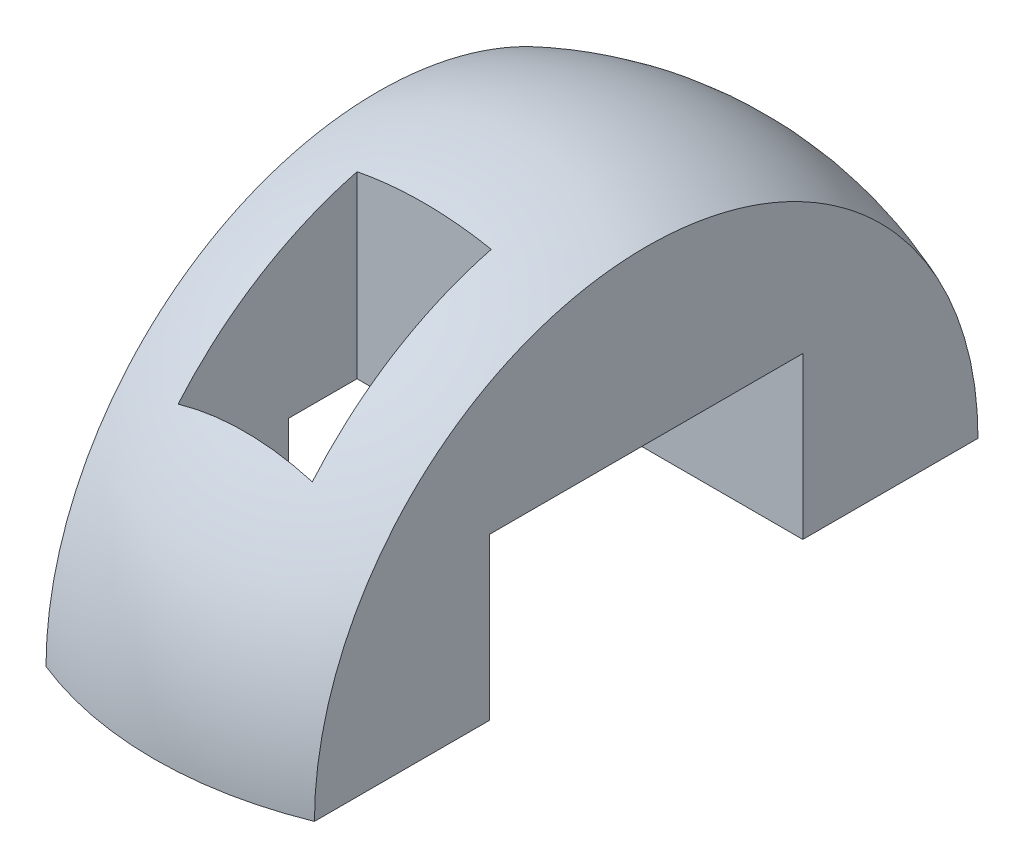
from build123d import *

# Parameters (mm, degrees)
SKETCH2_W          = 50
SKETCH2_H          = 80
CUT_EXTRUDE1_DEPTH = 196.959179423
SKETCH3_W          = 70
SKETCH3_H          = 36
CUT_EXTRUDE2_DEPTH = 129.062484749
SKETCH5_W          = 30
SKETCH5_H          = 40
CUT_EXTRUDE3_DEPTH = 118.046999107


with BuildPart() as part:
    # Sketch1 → Revolve2 (revolve)
    with BuildSketch(Plane.XY):
        with BuildLine():
            Line((0, 0), (80, 0))
            ThreePointArc((80, 0), (56.568542495, 56.568542495), (0, 80))
            Line((0, 80), (0, 0))
        make_face()
    revolve(axis=Axis((0, 0, 0), (0, 1, 0)))

    # Sketch2 → Cut-Extrude1 (cut, through all)
    with BuildSketch(Plane.XY.offset(80)):
        with Locations((55, 40)):
            Rectangle(SKETCH2_W, SKETCH2_H)
        with Locations((-55, 40)):
            Rectangle(SKETCH2_W, SKETCH2_H)
    extrude(amount=-CUT_EXTRUDE1_DEPTH, mode=Mode.SUBTRACT)

    # Sketch3 → Cut-Extrude2 (cut, through all)
    with BuildSketch(Plane.ZY.offset(30)):
        with Locations((0, 18)):
            Rectangle(SKETCH3_W, SKETCH3_H)
    extrude(amount=-CUT_EXTRUDE2_DEPTH, mode=Mode.SUBTRACT)

    # Sketch5 → Cut-Extrude3 (cut, through all)
    with BuildSketch(Plane(origin=(0, 80, 0), x_dir=(-1, 0, 0), z_dir=(0, -1, 0))):
        with Locations((-0.075942229, -39.717020611)):
            Rectangle(SKETCH5_W, SKETCH5_H)
    extrude(amount=CUT_EXTRUDE3_DEPTH, mode=Mode.SUBTRACT)


solid = part.part
